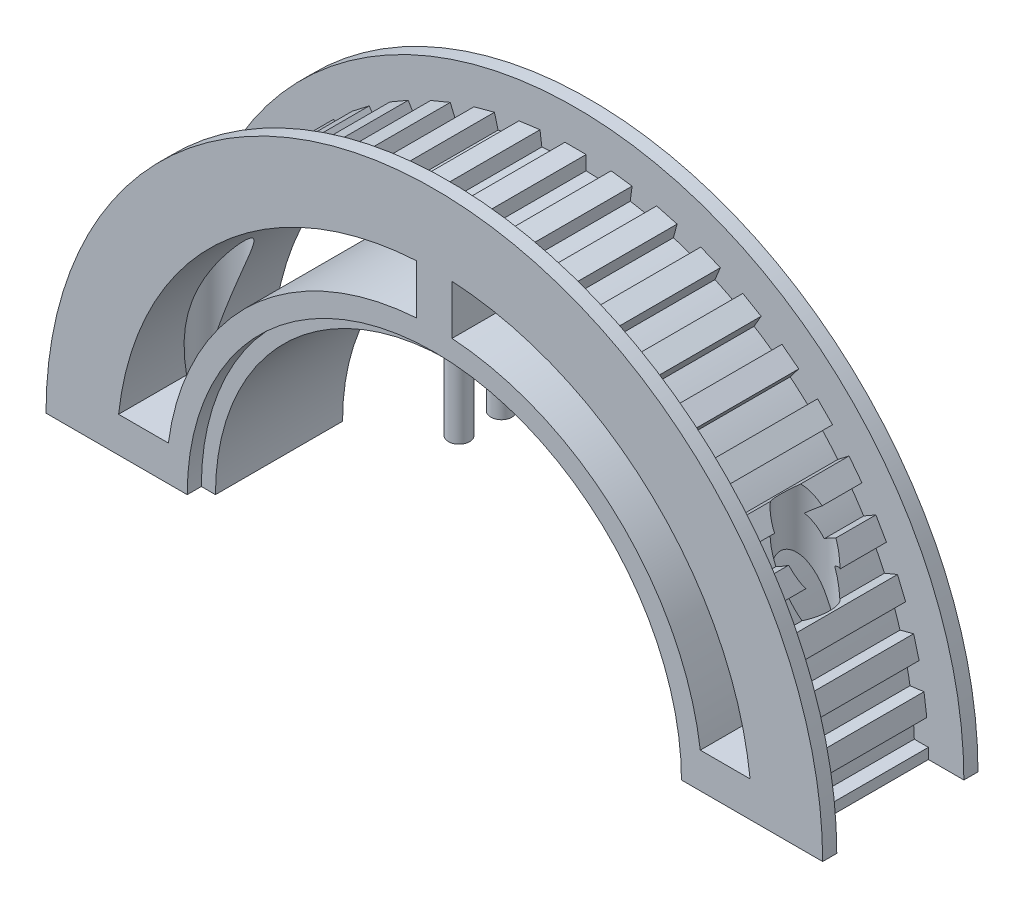
from build123d import *

# Parameters (mm, degrees)
BOSS_EXTRUDE1_DEPTH = 22
SKETCH10_R          = 1.75
CUT_EXTRUDE4_DEPTH  = 75.022378064
BOSS_EXTRUDE3_DEPTH = 2
BOSS_EXTRUDE4_START = -2
BOSS_EXTRUDE4_DEPTH = 2
BOSS_EXTRUDE5_DEPTH = 18
SKETCH11_R          = 3.5
CUT_EXTRUDE5_DEPTH  = 78.517739934
SKETCH14_R          = 1.5
BOSS_EXTRUDE6_DEPTH = 10
CUT_EXTRUDE8_DEPTH  = 2


with BuildPart() as part:
    # Sketch1 → Boss-Extrude1 (new body)
    with BuildSketch(Plane.XY):
        with BuildLine():
            Line((35, 0), (49.976556775, 0))
            Line((49.976556775, 0), (49.976556775, 1.5))
            Line((49.976556775, 1.5), (47.976556775, 1.5))
            ThreePointArc((47.976556775, 1.5), (47.897228315, 3.139350203), (47.761899969, 4.77502998))
            Line((47.761899969, 4.77502998), (49.744789692, 5.036082364))
            Line((49.744789692, 5.036082364), (49.353211116, 8.010416948))
            Line((49.353211116, 8.010416948), (47.370321393, 7.749364564))
            ThreePointArc((47.370321393, 7.749364564), (47.077693459, 9.364335457), (46.730023813, 10.968357872))
            Line((46.730023813, 10.968357872), (48.661875466, 11.485995963))
            Line((48.661875466, 11.485995963), (47.88541833, 14.383773441))
            Line((47.88541833, 14.383773441), (45.953566678, 13.866135351))
            ThreePointArc((45.953566678, 13.866135351), (45.452646216, 15.429094335), (44.898583993, 16.974014121))
            Line((44.898583993, 16.974014121), (46.746343059, 17.739380986))
            Line((46.746343059, 17.739380986), (45.598292761, 20.511019583))
            Line((45.598292761, 20.511019583), (43.750533696, 19.745652719))
            ThreePointArc((43.750533696, 19.745652719), (43.049891594, 21.229857131), (42.298916953, 22.689240282))
            Line((42.298916953, 22.689240282), (44.030967761, 23.689240282))
            Line((44.030967761, 23.689240282), (42.530967761, 26.287316493))
            Line((42.530967761, 26.287316493), (40.798916953, 25.287316493))
            ThreePointArc((40.798916953, 25.287316493), (39.910541391, 26.667371185), (38.975503717, 28.016247251))
            Line((38.975503717, 28.016247251), (40.562210397, 29.233770109))
            Line((40.562210397, 29.233770109), (38.73592611, 31.61383013))
            Line((38.73592611, 31.61383013), (37.14921943, 30.396307272))
            ThreePointArc((37.14921943, 30.396307272), (36.088310759, 31.648599125), (34.985208805, 32.863888462))
            Line((34.985208805, 32.863888462), (36.399422368, 34.278102024))
            Line((36.399422368, 34.278102024), (34.278102024, 36.399422368))
            Line((34.278102024, 36.399422368), (32.863888462, 34.985208805))
            ThreePointArc((32.863888462, 34.985208805), (31.648599125, 36.088310759), (30.396307272, 37.14921943))
            Line((30.396307272, 37.14921943), (31.61383013, 38.73592611))
            Line((31.61383013, 38.73592611), (29.233770109, 40.562210397))
            Line((29.233770109, 40.562210397), (28.016247251, 38.975503717))
            ThreePointArc((28.016247251, 38.975503717), (26.667371185, 39.910541391), (25.287316493, 40.798916953))
            Line((25.287316493, 40.798916953), (26.287316493, 42.530967761))
            Line((26.287316493, 42.530967761), (23.689240282, 44.030967761))
            Line((23.689240282, 44.030967761), (22.689240282, 42.298916953))
            ThreePointArc((22.689240282, 42.298916953), (21.229857131, 43.049891594), (19.745652719, 43.750533696))
            Line((19.745652719, 43.750533696), (20.511019583, 45.598292761))
            Line((20.511019583, 45.598292761), (17.739380986, 46.746343059))
            Line((17.739380986, 46.746343059), (16.974014121, 44.898583993))
            ThreePointArc((16.974014121, 44.898583993), (15.429094335, 45.452646216), (13.866135351, 45.953566678))
            Line((13.866135351, 45.953566678), (14.383773441, 47.88541833))
            Line((14.383773441, 47.88541833), (11.485995963, 48.661875466))
            Line((11.485995963, 48.661875466), (10.968357872, 46.730023813))
            ThreePointArc((10.968357872, 46.730023813), (9.364335457, 47.077693459), (7.749364564, 47.370321393))
            Line((7.749364564, 47.370321393), (8.010416948, 49.353211116))
            Line((8.010416948, 49.353211116), (5.036082364, 49.744789692))
            Line((5.036082364, 49.744789692), (4.77502998, 47.761899969))
            ThreePointArc((4.77502998, 47.761899969), (3.139350203, 47.897228315), (1.5, 47.976556775))
            Line((1.5, 47.976556775), (1.5, 49.976556775))
            Line((1.5, 49.976556775), (-1.5, 49.976556775))
            Line((-1.5, 49.976556775), (-1.5, 47.976556775))
            ThreePointArc((-1.5, 47.976556775), (-3.139350203, 47.897228315), (-4.77502998, 47.761899969))
            Line((-4.77502998, 47.761899969), (-5.036082364, 49.744789692))
            Line((-5.036082364, 49.744789692), (-8.010416948, 49.353211116))
            Line((-8.010416948, 49.353211116), (-7.749364564, 47.370321393))
            ThreePointArc((-7.749364564, 47.370321393), (-9.364335457, 47.077693459), (-10.968357872, 46.730023813))
            Line((-10.968357872, 46.730023813), (-11.485995963, 48.661875466))
            Line((-11.485995963, 48.661875466), (-14.383773441, 47.88541833))
            Line((-14.383773441, 47.88541833), (-13.866135351, 45.953566678))
            ThreePointArc((-13.866135351, 45.953566678), (-15.429094335, 45.452646216), (-16.974014121, 44.898583993))
            Line((-16.974014121, 44.898583993), (-17.739380986, 46.746343059))
            Line((-17.739380986, 46.746343059), (-20.511019583, 45.598292761))
            Line((-20.511019583, 45.598292761), (-19.745652719, 43.750533696))
            ThreePointArc((-19.745652719, 43.750533696), (-21.229857131, 43.049891594), (-22.689240282, 42.298916953))
            Line((-22.689240282, 42.298916953), (-23.689240282, 44.030967761))
            Line((-23.689240282, 44.030967761), (-26.287316493, 42.530967761))
            Line((-26.287316493, 42.530967761), (-25.287316493, 40.798916953))
            ThreePointArc((-25.287316493, 40.798916953), (-26.667371185, 39.910541391), (-28.016247251, 38.975503717))
            Line((-28.016247251, 38.975503717), (-29.233770109, 40.562210397))
            Line((-29.233770109, 40.562210397), (-31.61383013, 38.73592611))
            Line((-31.61383013, 38.73592611), (-30.396307272, 37.14921943))
            ThreePointArc((-30.396307272, 37.14921943), (-31.648599125, 36.088310759), (-32.863888462, 34.985208805))
            Line((-32.863888462, 34.985208805), (-34.278102024, 36.399422368))
            Line((-34.278102024, 36.399422368), (-36.399422368, 34.278102024))
            Line((-36.399422368, 34.278102024), (-34.985208805, 32.863888462))
            ThreePointArc((-34.985208805, 32.863888462), (-36.088310759, 31.648599125), (-37.14921943, 30.396307272))
            Line((-37.14921943, 30.396307272), (-38.73592611, 31.61383013))
            Line((-38.73592611, 31.61383013), (-40.562210397, 29.233770109))
            Line((-40.562210397, 29.233770109), (-38.975503717, 28.016247251))
            ThreePointArc((-38.975503717, 28.016247251), (-39.910541391, 26.667371185), (-40.798916953, 25.287316493))
            Line((-40.798916953, 25.287316493), (-42.530967761, 26.287316493))
            Line((-42.530967761, 26.287316493), (-44.030967761, 23.689240282))
            Line((-44.030967761, 23.689240282), (-42.298916953, 22.689240282))
            ThreePointArc((-42.298916953, 22.689240282), (-43.049891594, 21.229857131), (-43.750533696, 19.745652719))
            Line((-43.750533696, 19.745652719), (-45.598292761, 20.511019583))
            Line((-45.598292761, 20.511019583), (-46.746343059, 17.739380986))
            Line((-46.746343059, 17.739380986), (-44.898583993, 16.974014121))
            ThreePointArc((-44.898583993, 16.974014121), (-45.452646216, 15.429094335), (-45.953566678, 13.866135351))
            Line((-45.953566678, 13.866135351), (-47.88541833, 14.383773441))
            Line((-47.88541833, 14.383773441), (-48.661875466, 11.485995963))
            Line((-48.661875466, 11.485995963), (-46.730023813, 10.968357872))
            ThreePointArc((-46.730023813, 10.968357872), (-47.077693459, 9.364335457), (-47.370321393, 7.749364564))
            Line((-47.370321393, 7.749364564), (-49.353211116, 8.010416948))
            Line((-49.353211116, 8.010416948), (-49.744789692, 5.036082364))
            Line((-49.744789692, 5.036082364), (-47.761899969, 4.77502998))
            ThreePointArc((-47.761899969, 4.77502998), (-47.897228315, 3.139350203), (-47.976556775, 1.5))
            Line((-47.976556775, 1.5), (-49.976556775, 1.5))
            Line((-49.976556775, 1.5), (-49.976556775, 0))
            Line((-49.976556775, 0), (-35, 0))
            ThreePointArc((-35, 0), (0, 35), (35, 0))
        make_face()
        with BuildLine():
            Line((-37.669616404, 5), (-44.72135955, 5))
            ThreePointArc((-44.72135955, 5), (-30.920469672, 32.694411683), (-2.5, 44.930501889))
            Line((-2.5, 44.930501889), (-2.5, 37.917673979))
            ThreePointArc((-2.5, 37.917673979), (-25.967149161, 27.743596819), (-37.669616404, 5))
        make_face(mode=Mode.SUBTRACT)
        with BuildLine():
            ThreePointArc((2.5, 44.930501889), (30.920469672, 32.694411683), (44.72135955, 5))
            Line((44.72135955, 5), (37.669616404, 5))
            ThreePointArc((37.669616404, 5), (25.967149161, 27.743596819), (2.5, 37.917673979))
            Line((2.5, 37.917673979), (2.5, 44.930501889))
        make_face(mode=Mode.SUBTRACT)
    extrude(amount=BOSS_EXTRUDE1_DEPTH)

    # Sketch10 → Cut-Extrude4 (cut, through all)
    with BuildSketch(Plane(origin=(0, 0, 0), x_dir=(-1, 0, 0), z_dir=(0, -1, 0))):
        with Locations(Location((41.5, -11, 0), (0, 0, 90))):
            Circle(SKETCH10_R)
    cut_extrude4 = extrude(amount=-CUT_EXTRUDE4_DEPTH, mode=Mode.SUBTRACT)

    # Mirror4: Cut-Extrude4 across plane
    add(cut_extrude4.mirror(Plane(origin=(0, 0, 0), x_dir=(0, 0, 1), z_dir=(1, 0, 0))), mode=Mode.SUBTRACT)

    # Sketch5 → Boss-Extrude3 (add)
    with BuildSketch(Plane.XY):
        with BuildLine():
            Line((-48, 0), (-55, 0))
            ThreePointArc((-55, 0), (0, 55), (55, 0))
            Line((55, 0), (48, 0))
            ThreePointArc((48, 0), (0, 48), (-48, 0))
        make_face()
    extrude(amount=BOSS_EXTRUDE3_DEPTH)

    # Sketch6 → Boss-Extrude4 (add)
    with BuildSketch(Plane.XY.offset(22).offset(BOSS_EXTRUDE4_START)):
        with BuildLine():
            Line((-45, 0), (-55, 0))
            ThreePointArc((-55, 0), (0, 55), (55, 0))
            Line((55, 0), (45, 0))
            ThreePointArc((45, 0), (0, 45), (-45, 0))
        make_face()
    extrude(amount=BOSS_EXTRUDE4_DEPTH)

    # Sketch7 → Boss-Extrude5 (add)
    with BuildSketch(Plane.XY.offset(2)):
        with BuildLine():
            Line((-35, 0), (-33, 0))
            ThreePointArc((-33, 0), (0, 33), (33, 0))
            Line((33, 0), (35, 0))
            ThreePointArc((35, 0), (0, 35), (-35, 0))
        make_face()
    extrude(amount=BOSS_EXTRUDE5_DEPTH)

    # Sketch11 → Cut-Extrude5 (cut, through all)
    with BuildSketch(Plane(origin=(0, 5, 0), x_dir=(1, 0, 0), z_dir=(0, 1, 0))):
        with Locations(Location((-41.5, -11, 0), (0, 0, 78.44494507))):
            Circle(SKETCH11_R)
    cut_extrude5 = extrude(amount=CUT_EXTRUDE5_DEPTH, mode=Mode.SUBTRACT)

    # Mirror5: Cut-Extrude5 across plane
    add(cut_extrude5.mirror(Plane(origin=(0, 0, 0), x_dir=(0, 0, 1), z_dir=(1, 0, 0))), mode=Mode.SUBTRACT)

    # Sketch14 → Boss-Extrude6 (add)
    with BuildSketch(Plane(origin=(0, 33, 0), x_dir=(-1, 0, 0), z_dir=(0, -1, 0))):
        with Locations(Location((0, -18.5, 0), (0, 0, 270))):
            Circle(SKETCH14_R)
        with Locations(Location((0, -12.5, 0), (0, 0, 270))):
            Circle(SKETCH14_R)
    extrude(amount=BOSS_EXTRUDE6_DEPTH)

    # Sketch15 → Cut-Extrude8 (cut)
    with BuildSketch(Plane(origin=(0, 5, 0), x_dir=(1, 0, 0), z_dir=(0, 1, 0))):
        Polygon((-41.5, -14.175426481), (-38.75, -12.58771324), (-38.75, -9.41228676), (-41.5, -7.824573519), (-44.25, -9.41228676), (-44.25, -12.58771324), align=None)
    extrude(amount=-CUT_EXTRUDE8_DEPTH, mode=Mode.SUBTRACT)


solid = part.part
